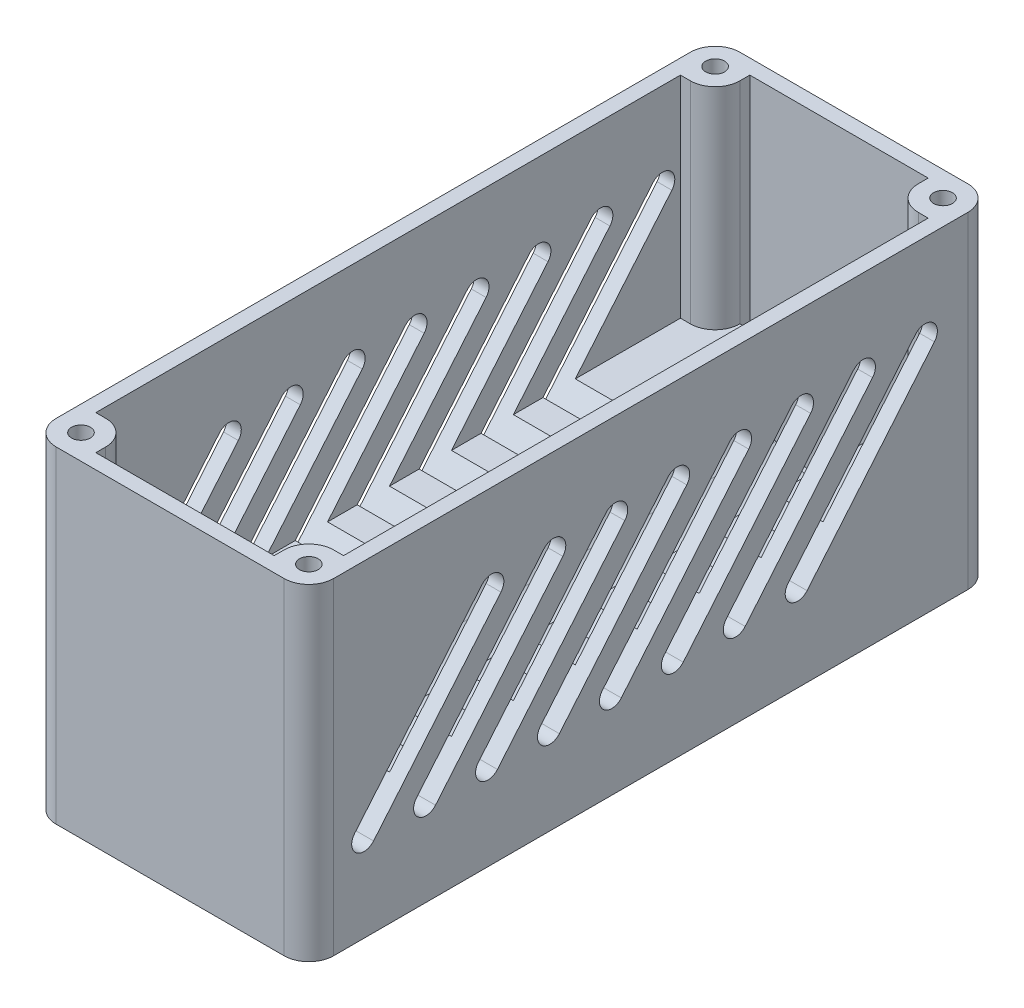
from build123d import *
from OCP.BRepFilletAPI import BRepFilletAPI_MakeFillet

# Parameters (mm, degrees)
SKETCH1_W               = 56
SKETCH1_H               = 138
BOSS_EXTRUDE1_DEPTH     = 65.95
SKETCH2_W               = 50
SKETCH2_H               = 132
CUT_EXTRUDE1_DEPTH      = 62.95
FILLET1_R1              = 2
FILLET1_R2              = 5
SKETCH3_R               = 1.9
BOSS_EXTRUDE2_DEPTH     = 62.95
MIRROR5_COPY_1_SKETCH_R = 1.9
MIRROR5_COPY_1_DEPTH    = 62.95
BOSS_EXTRUDE3_DEPTH     = 130
CUT_EXTRUDE2_DEPTH      = 74


with BuildPart() as part:
    # Sketch1 → Boss-Extrude1 (new body)
    with BuildSketch(Plane(origin=(0, 0, 0), x_dir=(1, 0, 0), z_dir=(0, 1, 0))):
        Rectangle(SKETCH1_W, SKETCH1_H)
    extrude(amount=BOSS_EXTRUDE1_DEPTH)

    # Sketch2 → Cut-Extrude1 (cut)
    with BuildSketch(Plane(origin=(0, 65.95, 0), x_dir=(1, 0, 0), z_dir=(0, 1, 0))):
        Rectangle(SKETCH2_W, SKETCH2_H)
    extrude(amount=-CUT_EXTRUDE1_DEPTH, mode=Mode.SUBTRACT)

    # Fillet1: one fillet with a radius per group of edges: ONE call of the kernel's fillet builder (fillet() takes one radius for all edges)
    fillet1_edges_1 = [part.edges().sort_by_distance(p)[0] for p in [
        (-25, 34.475, -66),
        (25, 34.475, -66),
        (-25, 34.475, 66),
        (25, 34.475, 66),
    ]]
    fillet1_edges_2 = [part.edges().sort_by_distance(p)[0] for p in [
        (-28, 32.975, -69),
        (28, 32.975, 69),
        (-28, 32.975, 69),
        (28, 32.975, -69),
    ]]
    fillet1 = BRepFilletAPI_MakeFillet(part.part.solid().wrapped)
    for e in fillet1_edges_1:
        fillet1.Add(FILLET1_R1, e.wrapped)
    for e in fillet1_edges_2:
        fillet1.Add(FILLET1_R2, e.wrapped)
    add(Compound.cast(fillet1.Shape()), mode=Mode.REPLACE)

    # Sketch3 → Boss-Extrude2 (add)
    with BuildSketch(Plane(origin=(0, 3, 0), x_dir=(1, 0, 0), z_dir=(0, 1, 0))):
        with BuildLine():
            Line((-23, 59), (-25, 59))
            Line((-25, 59), (-25, 64))
            ThreePointArc((-25, 64), (-24.414213562, 65.414213562), (-23, 66))
            Line((-23, 66), (-18, 66))
            Line((-18, 66), (-18, 64))
            ThreePointArc((-18, 64), (-19.464466094, 60.464466094), (-23, 59))
        make_face()
        with Locations(Location((-23, 64, 0), (0, 0, 90))):
            Circle(SKETCH3_R, mode=Mode.SUBTRACT)
    boss_extrude2 = extrude(amount=BOSS_EXTRUDE2_DEPTH)

    # Mirror4: Boss-Extrude2 across plane
    add(boss_extrude2.mirror(Plane.ZY))

    # Mirror5: Boss-Extrude2 across plane
    add(boss_extrude2.mirror(Plane.XY))

    # Mirror5 copy 1 sketch → Mirror5 copy 1 (add)
    with BuildSketch(Plane(origin=(0, 3, 0), x_dir=(-1, 0, 0), z_dir=(0, 1, 0))):
        with BuildLine():
            Line((-23, 59), (-25, 59))
            Line((-25, 59), (-25, 64))
            ThreePointArc((-25, 64), (-24.414213562, 65.414213562), (-23, 66))
            Line((-23, 66), (-18, 66))
            Line((-18, 66), (-18, 64))
            ThreePointArc((-18, 64), (-19.464466094, 60.464466094), (-23, 59))
        make_face()
        with Locations(Location((-23, 64, 0), (0, 0, 90))):
            Circle(MIRROR5_COPY_1_SKETCH_R, mode=Mode.SUBTRACT)
    extrude(amount=MIRROR5_COPY_1_DEPTH)

    # Sketch5 → Boss-Extrude3 (add)
    with BuildSketch(Plane(origin=(0, 0, 66), x_dir=(-1, 0, 0), z_dir=(0, 0, -1))):
        with BuildLine():
            ThreePointArc((0, 2.89979319), (-0.559053777, 2.942812119), (-1.116836261, 3))
            Line((-1.116836261, 3), (-18, 3))
            Line((-18, 3), (-18, 23.457091763))
            Line((-18, 23.457091763), (-26.3, 23.457091763))
            Line((-26.3, 23.457091763), (-26.3, 2.516966341))
            Line((-26.3, 2.516966341), (26.3, 2.516966341))
            Line((26.3, 2.516966341), (26.3, 23.457091763))
            Line((26.3, 23.457091763), (18, 23.457091763))
            Line((18, 23.457091763), (18, 3))
            Line((18, 3), (1.116836261, 3))
            ThreePointArc((1.116836261, 3), (0.559053777, 2.942812119), (0, 2.89979319))
        make_face()
        with BuildLine():
            Line((-18, 3), (-1.116836261, 3))
            ThreePointArc((-1.116836261, 3), (-6.149765384, 4.18974194), (-10.768389976, 6.516578486))
            ThreePointArc((-10.768389976, 6.516578486), (-14.0952442, 10.159119925), (-15.3, 14.942908237))
            Line((-15.3, 14.942908237), (-15.3, 23.457091763))
            Line((-15.3, 23.457091763), (-18, 23.457091763))
            Line((-18, 23.457091763), (-18, 3))
        make_face()
        with BuildLine():
            ThreePointArc((10.768389976, 6.516578486), (6.149765384, 4.18974194), (1.116836261, 3))
            Line((1.116836261, 3), (18, 3))
            Line((18, 3), (18, 23.457091763))
            Line((18, 23.457091763), (15.3, 23.457091763))
            Line((15.3, 23.457091763), (15.3, 14.942908237))
            ThreePointArc((15.3, 14.942908237), (14.0952442, 10.159119925), (10.768389976, 6.516578486))
        make_face()
    extrude(amount=BOSS_EXTRUDE3_DEPTH)

    # Sketch4 → Cut-Extrude2 (cut)
    with BuildSketch(Plane(origin=(28, 0, 0), x_dir=(0, 0, -1), z_dir=(1, 0, 0))):
        with BuildLine():
            Line((-59.770863302, 19.261080162), (-34.059358914, 49.902857887))
            ThreePointArc((-34.059358914, 49.902857887), (-30.537278782, 50.21099997), (-30.229136698, 46.688919838))
            Line((-30.229136698, 46.688919838), (-55.940641086, 16.047142113))
            ThreePointArc((-55.940641086, 16.047142113), (-59.462721218, 15.73900003), (-59.770863302, 19.261080162))
        make_face()
        with BuildLine():
            Line((-47.270863302, 19.261080162), (-21.559358914, 49.902857887))
            ThreePointArc((-21.559358914, 49.902857887), (-18.037278782, 50.21099997), (-17.729136698, 46.688919838))
            Line((-17.729136698, 46.688919838), (-43.440641086, 16.047142113))
            ThreePointArc((-43.440641086, 16.047142113), (-46.962721218, 15.73900003), (-47.270863302, 19.261080162))
        make_face()
        with BuildLine():
            Line((-34.770863302, 19.261080162), (-9.059358914, 49.902857887))
            ThreePointArc((-9.059358914, 49.902857887), (-5.537278782, 50.21099997), (-5.229136698, 46.688919838))
            Line((-5.229136698, 46.688919838), (-30.940641086, 16.047142113))
            ThreePointArc((-30.940641086, 16.047142113), (-34.462721218, 15.73900003), (-34.770863302, 19.261080162))
        make_face()
        with BuildLine():
            Line((-22.270863302, 19.261080162), (3.440641086, 49.902857887))
            ThreePointArc((3.440641086, 49.902857887), (6.962721218, 50.21099997), (7.270863302, 46.688919838))
            Line((7.270863302, 46.688919838), (-18.440641086, 16.047142113))
            ThreePointArc((-18.440641086, 16.047142113), (-21.962721218, 15.73900003), (-22.270863302, 19.261080162))
        make_face()
        with BuildLine():
            Line((-9.770863302, 19.261080162), (15.940641086, 49.902857887))
            ThreePointArc((15.940641086, 49.902857887), (19.462721218, 50.21099997), (19.770863302, 46.688919838))
            Line((19.770863302, 46.688919838), (-5.940641086, 16.047142113))
            ThreePointArc((-5.940641086, 16.047142113), (-9.462721218, 15.73900003), (-9.770863302, 19.261080162))
        make_face()
        with BuildLine():
            Line((2.729136698, 19.261080162), (28.440641086, 49.902857887))
            ThreePointArc((28.440641086, 49.902857887), (31.962721218, 50.21099997), (32.270863302, 46.688919838))
            Line((32.270863302, 46.688919838), (6.559358914, 16.047142113))
            ThreePointArc((6.559358914, 16.047142113), (3.037278782, 15.73900003), (2.729136698, 19.261080162))
        make_face()
        with BuildLine():
            Line((15.229136698, 19.261080162), (40.940641086, 49.902857887))
            ThreePointArc((40.940641086, 49.902857887), (44.462721218, 50.21099997), (44.770863302, 46.688919838))
            Line((44.770863302, 46.688919838), (19.059358914, 16.047142113))
            ThreePointArc((19.059358914, 16.047142113), (15.537278782, 15.73900003), (15.229136698, 19.261080162))
        make_face()
        with BuildLine():
            Line((27.729136698, 19.261080162), (53.440641086, 49.902857887))
            ThreePointArc((53.440641086, 49.902857887), (56.962721218, 50.21099997), (57.270863302, 46.688919838))
            Line((57.270863302, 46.688919838), (31.559358914, 16.047142113))
            ThreePointArc((31.559358914, 16.047142113), (28.037278782, 15.73900003), (27.729136698, 19.261080162))
        make_face()
    extrude(amount=-CUT_EXTRUDE2_DEPTH, mode=Mode.SUBTRACT)


solid = part.part
